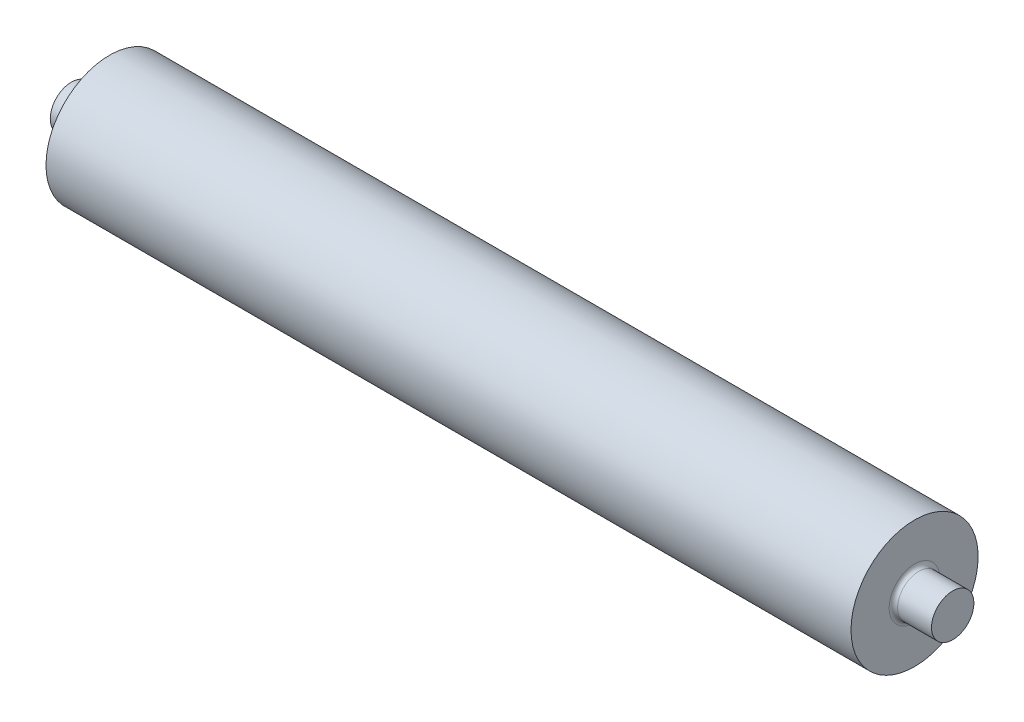
from build123d import *

# Parameters (mm, degrees)
FILLET1_R = 10


with BuildPart() as part:
    # Sketch1 → Revolve1 (revolve)
    with BuildSketch(Plane.XY, mode=Mode.PRIVATE) as revolve1_sk:
        Polygon((-1040, 0), (1040, 0), (1040, 50), (950, 50), (950, 150), (-950, 150), (-950, 50), (-1040, 50), align=None)
    revolve(revolve1_sk.sketch.rotate(Axis((-1040, 0, 0), (1, 0, 0)), 90), axis=Axis((-1040, 0, 0), (1, 0, 0)))

    # Fillet1
    fillet1_edges = [part.edges().sort_by_distance(p)[0] for p in [
        (-950, 0, -50),
        (950, 0, -50),
    ]]
    fillet(fillet1_edges, radius=FILLET1_R)


solid = part.part
